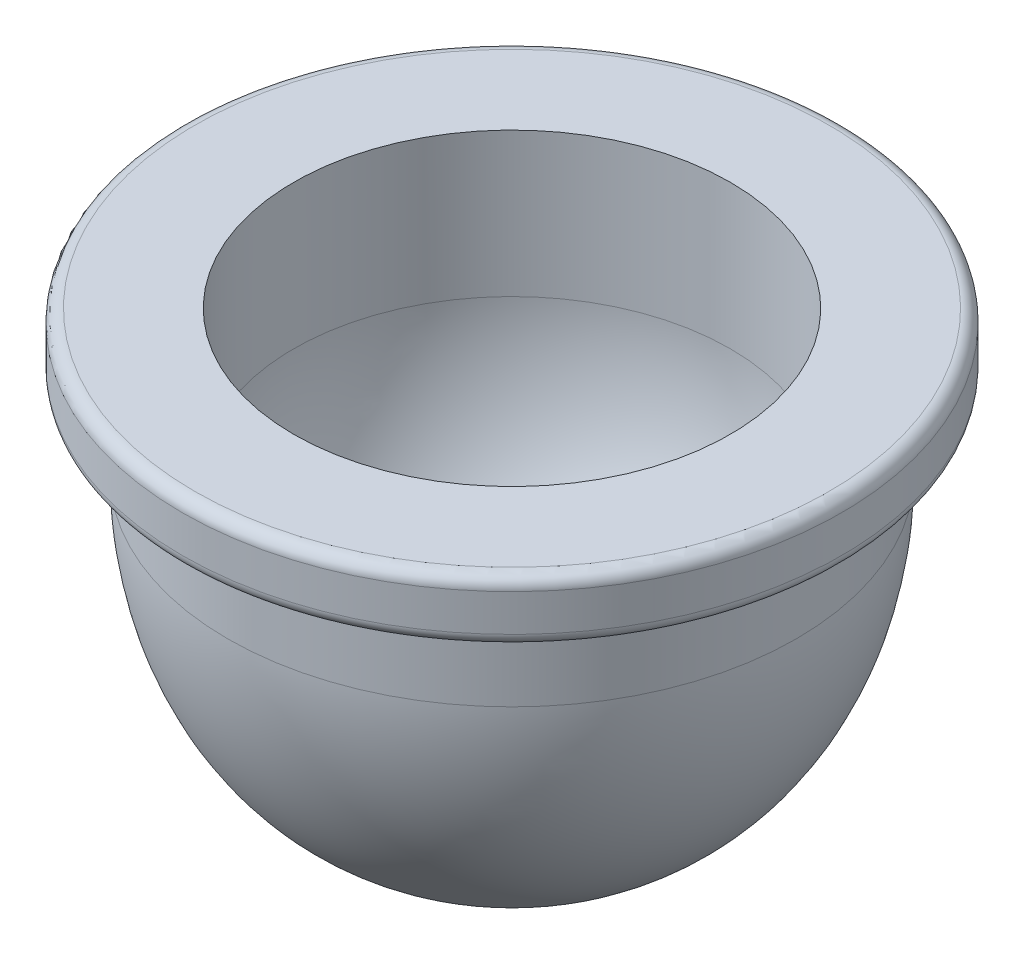
from build123d import *

# Parameters (mm, degrees)
FILLET1_R = 0.3


with BuildPart() as part:
    # Sketch1 → Revolve3 (revolve)
    with BuildSketch(Plane.XY, mode=Mode.PRIVATE) as revolve3_sk:
        with BuildLine():
            Line((6.9, 9.5), (6.9, 7.5))
            add(Edge.make_bspline(
                [(6.9, 7.5), (6.9, 4.10294245), (4.871285713, 0), (0, 0)],
                knots=[0, 0, 0, 0, 1, 1, 1, 1], degree=3))
            Line((0, 0), (0, 1.6))
            add(Edge.make_bspline(
                [(5.3, 7.5), (5.3, 7.144881401), (5.24816132, 6.443519854), (4.924753283, 4.993438199), (4.271690968, 3.676921203), (3.319488403, 2.672645151), (2.451505389, 2.093584156), (1.558148415, 1.768951237), (0.724232404, 1.626097054), (0.235783562, 1.6), (0, 1.6)],
                knots=[0, 0, 0, 0, 0.125, 0.25, 0.5, 0.625, 0.75, 0.875, 0.9375, 1, 1, 1, 1], degree=3))
            Line((5.3, 7.5), (5.3, 11))
            Line((5.3, 11), (6.9, 11))
            Line((6.9, 11), (8, 11))
            Line((8, 11), (8, 9.5))
            Line((8, 9.5), (6.9, 9.5))
        make_face()
    revolve(revolve3_sk.sketch.rotate(Axis((0, 0, 0), (0, 1, 0)), 90), axis=Axis((0, 0, 0), (0, 1, 0)))

    # Fillet1
    fillet1_edges = [part.edges().sort_by_distance(p)[0] for p in [
        (0, 11, 8),
        (0, 9.5, 8),
    ]]
    fillet(fillet1_edges, radius=FILLET1_R)


solid = part.part
